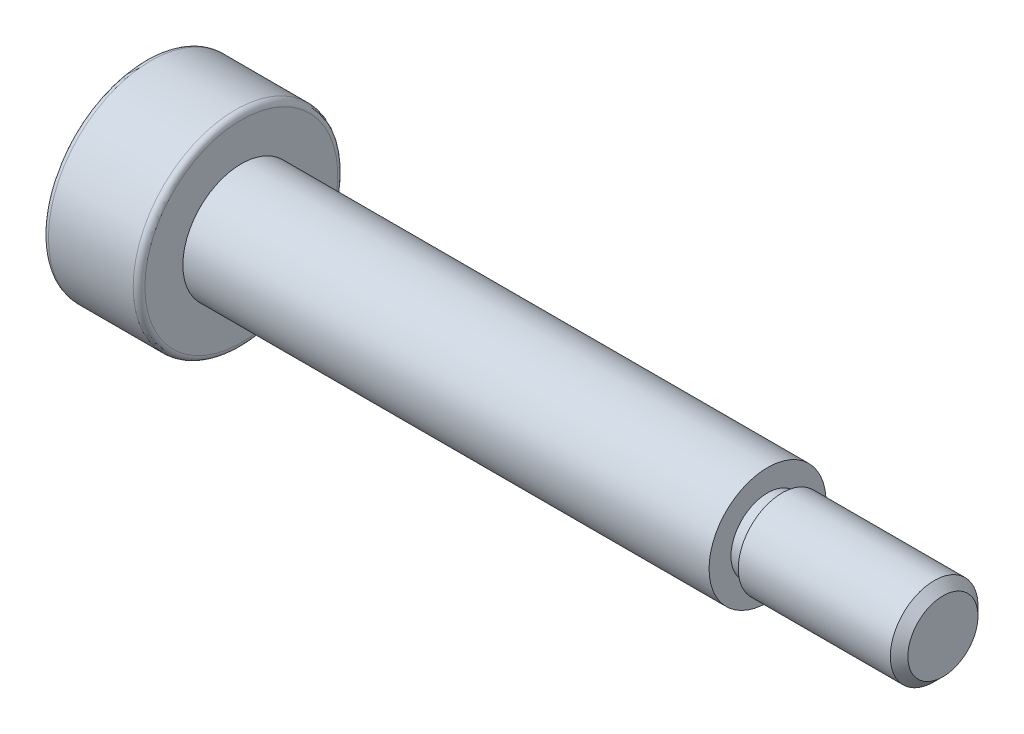
from build123d import *

# Parameters (mm, degrees)
FILLET_1_R          = 0.2
CHAMFER_1_SIZE      = 0.3
SKETCH_3_W          = 0.5
SKETCH_3_H          = 0.25
CUT_EXTRUDE_1_DEPTH = 2


with BuildPart() as part:
    # 草图1 → 旋转1 (revolve)
    with BuildSketch(Plane.XY, mode=Mode.PRIVATE) as revolve_1_sk:
        Polygon((-13.65, 0), (-13.65, 3.5), (-10.35, 3.5), (-10.35, 2), (7.65, 2), (7.65, 1.5), (13.65, 1.5), (13.65, 0), align=None)
    revolve(revolve_1_sk.sketch.rotate(Axis((-13.65, 0, 0), (1, 0, 0)), 90), axis=Axis((-13.65, 0, 0), (1, 0, 0)))

    # 圆角1
    fillet_1_edges = [part.edges().sort_by_distance(p)[0] for p in [
        (-10.35, 0, -3.5),
        (-13.65, 0, -3.5),
    ]]
    fillet(fillet_1_edges, radius=FILLET_1_R)

    # 倒角1
    chamfer_1_edges = [part.edges().sort_by_distance(p)[0] for p in [
        (13.65, 0, -1.5),
    ]]
    chamfer(chamfer_1_edges, length=CHAMFER_1_SIZE)

    # 草图3 → 切除-旋转1 (revolve, cut)
    with BuildSketch(Plane.XY, mode=Mode.PRIVATE) as cut_revolve_1_sk:
        with Locations((7.9, 1.375)):
            Rectangle(SKETCH_3_W, SKETCH_3_H)
    revolve(cut_revolve_1_sk.sketch.rotate(Axis((7.65, 0, 0), (1, 0, 0)), 90), axis=Axis((7.65, 0, 0), (1, 0, 0)), mode=Mode.SUBTRACT)

    # 草图4 → 切除-拉伸1 (cut)
    with BuildSketch(Plane.ZY.offset(13.65)):
        Polygon((1.732050808, 0), (0.866025404, 1.5), (-0.866025404, 1.5), (-1.732050808, 0), (-0.866025404, -1.5), (0.866025404, -1.5), align=None)
    extrude(amount=-CUT_EXTRUDE_1_DEPTH, mode=Mode.SUBTRACT)


solid = part.part
